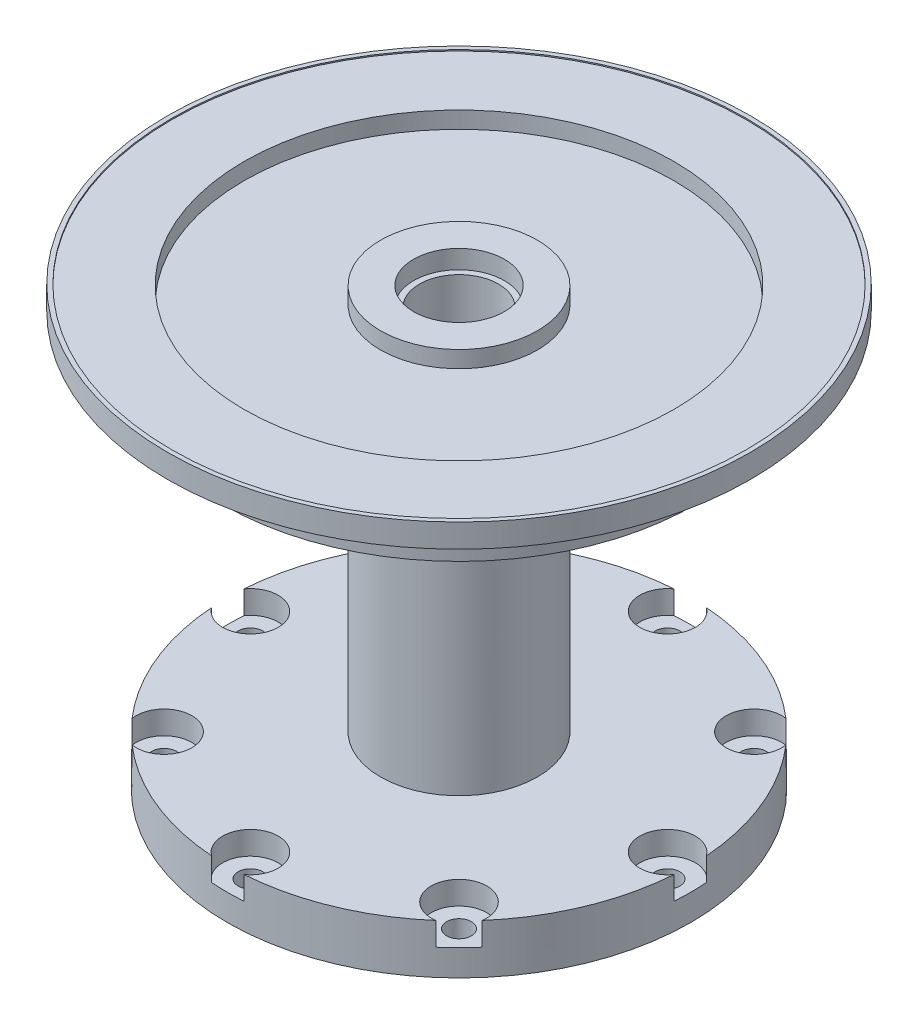
from build123d import *

# Parameters (mm, degrees)
SKETCH1_R           = 38.1
BOSS_EXTRUDE1_DEPTH = 4.826
SKETCH2_R           = 38.1
BOSS_EXTRUDE2_DEPTH = 3.302
BOSS_EXTRUDE2_DRAFT = -70
SKETCH3_R           = 47.172170439
BOSS_EXTRUDE3_DEPTH = 3.81
SKETCH4_R           = 46.472170439
CUT_EXTRUDE1_DEPTH  = 0.2
SKETCH6_R           = 34.772170439
SKETCH6_R_2         = 12.7
CUT_EXTRUDE2_DEPTH  = 2.7
SKETCH8_R           = 12.7
BOSS_EXTRUDE4_DEPTH = 50.8
SKETCH10_R          = 7.35
CUT_EXTRUDE5_DEPTH  = 3
SKETCH13_R          = 6.4
CUT_EXTRUDE9_DEPTH  = 92.577748235
SKETCH15_R          = 37.5
BOSS_EXTRUDE6_DEPTH = 8
CUT_EXTRUDE10_REACH = 99.233
SKETCH16_R          = 2
SKETCH16_R_2        = 5.35
SKETCH17_R          = 20.71
SKETCH17_R_2        = 19.21
CUT_EXTRUDE11_DEPTH = 3
SKETCH19_R          = 4.5
CUT_EXTRUDE12_DEPTH = 3.75


with BuildPart() as part:
    # Sketch1 → Boss-Extrude1 (new body)
    with BuildSketch(Plane(origin=(0, 0, 0), x_dir=(1, 0, 0), z_dir=(0, 1, 0))):
        with Locations(Location((0, 0, 0), (0, 0, 270))):
            Circle(SKETCH1_R)
    extrude(amount=BOSS_EXTRUDE1_DEPTH)


with BuildPart() as boss_extrude2_tool:
    # Sketch2 → Boss-Extrude2 (with draft: the straight prism first)
    with BuildSketch(Plane(origin=(0, 4.826, 0), x_dir=(1, 0, 0), z_dir=(0, 1, 0))):
        with Locations(Location((0, 0, 0), (0, 0, 270))):
            Circle(SKETCH2_R)
    extrude(amount=BOSS_EXTRUDE2_DEPTH)
    # Boss-Extrude2: the draft: its side faces are tilted about the plane it starts from
    boss_extrude2_sides = [boss_extrude2_tool.faces().sort_by_distance(p)[0] for p in [
        (0, 6.477, -38.1),
    ]]
    draft(boss_extrude2_sides, Plane(origin=(0, 4.826, 0), x_dir=(1, 0, 0), z_dir=(0, 1, 0)), BOSS_EXTRUDE2_DRAFT)


with BuildPart() as part_1:
    add(part.part)

    # Boss-Extrude2: add boss_extrude2_tool
    add(boss_extrude2_tool.part)

    # Sketch3 → Boss-Extrude3 (add)
    with BuildSketch(Plane(origin=(0, 8.128, 0), x_dir=(1, 0, 0), z_dir=(0, 1, 0))):
        with Locations(Location((0, 0, 0), (0, 0, 90))):
            Circle(SKETCH3_R)
    extrude(amount=BOSS_EXTRUDE3_DEPTH)

    # Sketch4 → Cut-Extrude1 (cut)
    with BuildSketch(Plane(origin=(0, 11.938, 0), x_dir=(1, 0, 0), z_dir=(0, 1, 0))):
        with Locations(Location((0, 0, 0), (0, 0, 270))):
            Circle(SKETCH4_R)
    extrude(amount=-CUT_EXTRUDE1_DEPTH, mode=Mode.SUBTRACT)

    # Sketch6 → Cut-Extrude2 (cut)
    with BuildSketch(Plane(origin=(0, 11.738, 0), x_dir=(1, 0, 0), z_dir=(0, 1, 0))):
        with Locations(Location((0, 0, 0), (0, 0, 270))):
            Circle(SKETCH6_R)
        with Locations(Location((0, 0, 0), (0, 0, 270))):
            Circle(SKETCH6_R_2, mode=Mode.SUBTRACT)
    extrude(amount=-CUT_EXTRUDE2_DEPTH, mode=Mode.SUBTRACT)

    # Sketch8 → Boss-Extrude4 (add)
    with BuildSketch(Plane.XZ):
        with Locations(Location((0, 0, 0), (0, 0, 90))):
            Circle(SKETCH8_R)
    extrude(amount=BOSS_EXTRUDE4_DEPTH)

    # Sketch10 → Cut-Extrude5 (cut)
    with BuildSketch(Plane(origin=(0, 11.738, 0), x_dir=(1, 0, 0), z_dir=(0, 1, 0))):
        with Locations(Location((0, 0, 0), (0, 0, 270))):
            Circle(SKETCH10_R)
    extrude(amount=-CUT_EXTRUDE5_DEPTH, mode=Mode.SUBTRACT)

    # Sketch13 → Cut-Extrude9 (cut, through all)
    with BuildSketch(Plane(origin=(0, -50.8, 0), x_dir=(-1, 0, 0), z_dir=(0, -1, 0))):
        with Locations(Location((0, 0, 0), (0, 0, 90))):
            Circle(SKETCH13_R)
    extrude(amount=-CUT_EXTRUDE9_DEPTH, mode=Mode.SUBTRACT)

    # Sketch15 → Boss-Extrude6 (add)
    with BuildSketch(Plane.XZ.offset(50.8)):
        with Locations(Location((0, 0, 0), (0, 0, 270))):
            Circle(SKETCH15_R)
    extrude(amount=BOSS_EXTRUDE6_DEPTH)

    # Sketch16 → Cut-Extrude10 (cut, up to next)
    with BuildSketch(Plane.XZ.offset(58.8), mode=Mode.PRIVATE) as cut_extrude10_sk1:
        with Locations(Location((0, 33.75, 0), (0, 0, 270))):
            Circle(SKETCH16_R)
    cut_extrude10_tool1 = extrude(cut_extrude10_sk1.sketch, amount=-CUT_EXTRUDE10_REACH, mode=Mode.PRIVATE) & part_1.part
    # Sketch16 → Cut-Extrude10 (cut, up to next)
    with BuildSketch(Plane.XZ.offset(58.8), mode=Mode.PRIVATE) as cut_extrude10_sk2:
        with Locations(Location((23.864853865, 23.864853865, 0), (0, 0, 270))):
            Circle(SKETCH16_R)
    cut_extrude10_tool2 = extrude(cut_extrude10_sk2.sketch, amount=-CUT_EXTRUDE10_REACH, mode=Mode.PRIVATE) & part_1.part
    # Sketch16 → Cut-Extrude10 (cut, up to next)
    with BuildSketch(Plane.XZ.offset(58.8), mode=Mode.PRIVATE) as cut_extrude10_sk3:
        with Locations(Location((33.75, 0, 0), (0, 0, 270))):
            Circle(SKETCH16_R)
    cut_extrude10_tool3 = extrude(cut_extrude10_sk3.sketch, amount=-CUT_EXTRUDE10_REACH, mode=Mode.PRIVATE) & part_1.part
    # Sketch16 → Cut-Extrude10 (cut, up to next)
    with BuildSketch(Plane.XZ.offset(58.8), mode=Mode.PRIVATE) as cut_extrude10_sk4:
        with Locations(Location((23.864853865, -23.864853865, 0), (0, 0, 270))):
            Circle(SKETCH16_R)
    cut_extrude10_tool4 = extrude(cut_extrude10_sk4.sketch, amount=-CUT_EXTRUDE10_REACH, mode=Mode.PRIVATE) & part_1.part
    # Sketch16 → Cut-Extrude10 (cut, up to next)
    with BuildSketch(Plane.XZ.offset(58.8), mode=Mode.PRIVATE) as cut_extrude10_sk5:
        with Locations(Location((0, -33.75, 0), (0, 0, 270))):
            Circle(SKETCH16_R)
    cut_extrude10_tool5 = extrude(cut_extrude10_sk5.sketch, amount=-CUT_EXTRUDE10_REACH, mode=Mode.PRIVATE) & part_1.part
    # Sketch16 → Cut-Extrude10 (cut, up to next)
    with BuildSketch(Plane.XZ.offset(58.8), mode=Mode.PRIVATE) as cut_extrude10_sk6:
        with Locations(Location((-23.864853865, -23.864853865, 0), (0, 0, 270))):
            Circle(SKETCH16_R)
    cut_extrude10_tool6 = extrude(cut_extrude10_sk6.sketch, amount=-CUT_EXTRUDE10_REACH, mode=Mode.PRIVATE) & part_1.part
    # Sketch16 → Cut-Extrude10 (cut, up to next)
    with BuildSketch(Plane.XZ.offset(58.8), mode=Mode.PRIVATE) as cut_extrude10_sk7:
        with Locations(Location((-33.75, 0, 0), (0, 0, 270))):
            Circle(SKETCH16_R)
    cut_extrude10_tool7 = extrude(cut_extrude10_sk7.sketch, amount=-CUT_EXTRUDE10_REACH, mode=Mode.PRIVATE) & part_1.part
    # Sketch16 → Cut-Extrude10 (cut, up to next)
    with BuildSketch(Plane.XZ.offset(58.8), mode=Mode.PRIVATE) as cut_extrude10_sk8:
        with Locations(Location((-23.864853865, 23.864853865, 0), (0, 0, 270))):
            Circle(SKETCH16_R)
    cut_extrude10_tool8 = extrude(cut_extrude10_sk8.sketch, amount=-CUT_EXTRUDE10_REACH, mode=Mode.PRIVATE) & part_1.part
    # Sketch16 → Cut-Extrude10 (cut, up to next)
    with BuildSketch(Plane.XZ.offset(58.8), mode=Mode.PRIVATE) as cut_extrude10_sk9:
        with Locations(Location((0, 0, 0), (0, 0, 270))):
            Circle(SKETCH16_R_2)
    cut_extrude10_tool9 = extrude(cut_extrude10_sk9.sketch, amount=-CUT_EXTRUDE10_REACH, mode=Mode.PRIVATE) & part_1.part
    add(cut_extrude10_tool1.solids().sort_by_distance((0, -58.8, 33.75))[0], mode=Mode.SUBTRACT)
    add(cut_extrude10_tool2.solids().sort_by_distance((23.864854, -58.8, 23.864854))[0], mode=Mode.SUBTRACT)
    add(cut_extrude10_tool3.solids().sort_by_distance((33.75, -58.8, 0))[0], mode=Mode.SUBTRACT)
    add(cut_extrude10_tool4.solids().sort_by_distance((23.864854, -58.8, -23.864854))[0], mode=Mode.SUBTRACT)
    add(cut_extrude10_tool5.solids().sort_by_distance((0, -58.8, -33.75))[0], mode=Mode.SUBTRACT)
    add(cut_extrude10_tool6.solids().sort_by_distance((-23.864854, -58.8, -23.864854))[0], mode=Mode.SUBTRACT)
    add(cut_extrude10_tool7.solids().sort_by_distance((-33.75, -58.8, 0))[0], mode=Mode.SUBTRACT)
    add(cut_extrude10_tool8.solids().sort_by_distance((-23.864854, -58.8, 23.864854))[0], mode=Mode.SUBTRACT)
    add(cut_extrude10_tool9.solids().sort_by_distance((0, -58.8, 0))[0], mode=Mode.SUBTRACT)

    # Sketch17 → Cut-Extrude11 (cut)
    with BuildSketch(Plane.XZ.offset(58.8)):
        with Locations(Location((0, 0, 0), (0, 0, 270))):
            Circle(SKETCH17_R)
        with Locations(Location((0, 0, 0), (0, 0, 270))):
            Circle(SKETCH17_R_2, mode=Mode.SUBTRACT)
    extrude(amount=-CUT_EXTRUDE11_DEPTH, mode=Mode.SUBTRACT)

    # Sketch19 → Cut-Extrude12 (cut)
    with BuildSketch(Plane(origin=(0, -50.8, 0), x_dir=(1, 0, 0), z_dir=(0, 1, 0))):
        with Locations((23.864853865, 23.864853865)):
            Circle(SKETCH19_R)
        with Locations((0, 33.75)):
            Circle(SKETCH19_R)
        with Locations((33.75, 0)):
            Circle(SKETCH19_R)
        with Locations((23.864853865, -23.864853865)):
            Circle(SKETCH19_R)
        with Locations((0, -33.75)):
            Circle(SKETCH19_R)
        with Locations((-23.864853865, -23.864853865)):
            Circle(SKETCH19_R)
        with Locations((-33.75, 0)):
            Circle(SKETCH19_R)
        with Locations((-23.864853865, 23.864853865)):
            Circle(SKETCH19_R)
    extrude(amount=-CUT_EXTRUDE12_DEPTH, mode=Mode.SUBTRACT)


solid = part_1.part
